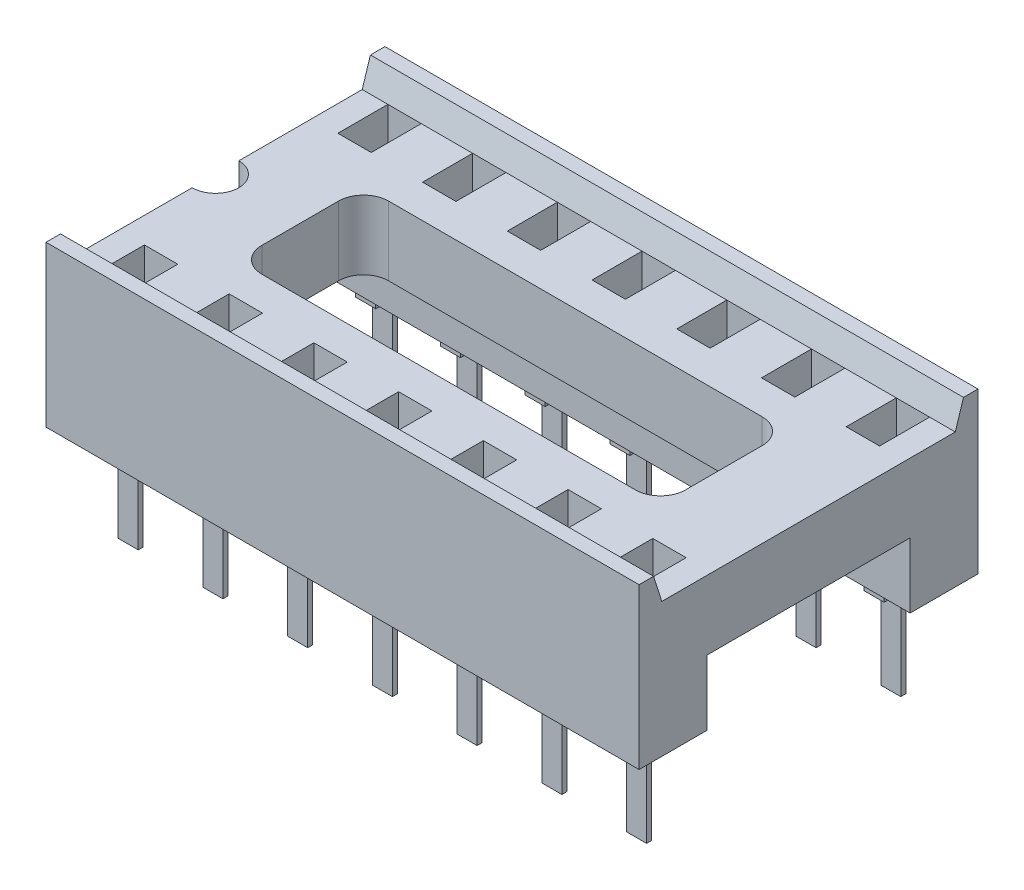
from build123d import *

# Parameters (mm, degrees)
EXTRUDE_1_DEPTH     = 8.89
CUT_EXTRUDE_1_REACH = 14.417
CUT_EXTRUDE_2_REACH = 14.417
SKETCH_3_4_W        = 1
SKETCH_3_4_H        = 1.5
CUT_EXTRUDE_3_DEPTH = 1
SKETCH_4_W          = 0.97
SKETCH_4_H          = 3
SKETCH_4_W_2        = 1.94
CUT_EXTRUDE_4_DEPTH = 14.507158287


with BuildPart() as part:
    # Эскиз2 → Бобышка-Вытянуть1 (new, symmetric)
    with BuildSketch(Plane(origin=(0, 0, 0), x_dir=(0, 0, -1), z_dir=(1, 0, 0))):
        Polygon((4.399571873, 4.024999392), (-4.399571873, 4.024999392), (-4.64484088, 4.8), (-5.08, 4.8), (-5.08, 0), (-3.885, 0), (-3.885, -3), (-3.735, -3), (-3.735, -0.3), (-3.235, -0.3), (-3.235, 0), (-3.045579843, 0), (-3.045579843, 1.95423056), (3.045579843, 1.95423056), (3.045579843, 0), (3.235, 0), (3.235, -0.3), (3.735, -0.3), (3.735, -3), (3.885, -3), (3.885, 0), (5.08, 0), (5.08, 4.8), (4.64484088, 4.8), align=None)
    extrude(amount=EXTRUDE_1_DEPTH, both=True)

    # Эскиз3 → Вырез-Вытянуть1 (cut, up to next)
    with BuildSketch(Plane(origin=(0, 4.024999392, 0), x_dir=(1, 0, 0), z_dir=(0, 1, 0)), mode=Mode.PRIVATE) as cut_extrude_1_sk1:
        with BuildLine():
            Line((-8.89, 0.7), (-8.89, -0.7))
            ThreePointArc((-8.89, -0.7), (-8.19, 0), (-8.89, 0.7))
        make_face()
    cut_extrude_1_tool1 = extrude(cut_extrude_1_sk1.sketch, amount=-CUT_EXTRUDE_1_REACH, mode=Mode.PRIVATE) & part.part
    add(cut_extrude_1_tool1.solids().sort_by_distance((-8.592911, 4.024999, 0))[0], mode=Mode.SUBTRACT)

    # Эскиз3<3> → Вырез-Вытянуть2 (cut, up to next)
    with BuildSketch(Plane(origin=(0, 4.024999392, 0), x_dir=(1, 0, 0), z_dir=(0, 1, 0)), mode=Mode.PRIVATE) as cut_extrude_2_sk1:
        with BuildLine():
            Line((-6.35, 1.149571873), (-6.35, -1.149571873))
            ThreePointArc((-6.35, -1.149571873), (-6.130330086, -1.679901959), (-5.6, -1.899571873))
            Line((-5.6, -1.899571873), (5.6, -1.899571873))
            ThreePointArc((5.6, -1.899571873), (6.130330086, -1.679901959), (6.35, -1.149571873))
            Line((6.35, -1.149571873), (6.35, 1.149571873))
            ThreePointArc((6.35, 1.149571873), (6.130330086, 1.679901959), (5.6, 1.899571873))
            Line((5.6, 1.899571873), (-5.6, 1.899571873))
            ThreePointArc((-5.6, 1.899571873), (-6.130330086, 1.679901959), (-6.35, 1.149571873))
        make_face()
    cut_extrude_2_tool1 = extrude(cut_extrude_2_sk1.sketch, amount=-CUT_EXTRUDE_2_REACH, mode=Mode.PRIVATE) & part.part
    add(cut_extrude_2_tool1.solids().sort_by_distance((0, 4.024999, 0))[0], mode=Mode.SUBTRACT)

    # Эскиз3<4> → Вырез-Вытянуть3 (cut)
    with BuildSketch(Plane(origin=(0, 4.024999392, 0), x_dir=(1, 0, 0), z_dir=(0, 1, 0))):
        with Locations((-7.62, 3.649571873)):
            Rectangle(SKETCH_3_4_W, SKETCH_3_4_H)
        with Locations((7.62, 3.649571873)):
            Rectangle(SKETCH_3_4_W, SKETCH_3_4_H)
        with Locations((5.08, 3.649571873)):
            Rectangle(SKETCH_3_4_W, SKETCH_3_4_H)
        with Locations((2.54, 3.649571873)):
            Rectangle(SKETCH_3_4_W, SKETCH_3_4_H)
        with Locations((0, 3.649571873)):
            Rectangle(SKETCH_3_4_W, SKETCH_3_4_H)
        with Locations((-2.54, 3.649571873)):
            Rectangle(SKETCH_3_4_W, SKETCH_3_4_H)
        with Locations((-5.08, 3.649571873)):
            Rectangle(SKETCH_3_4_W, SKETCH_3_4_H)
        with Locations((-7.62, -3.649571873)):
            Rectangle(SKETCH_3_4_W, SKETCH_3_4_H)
        with Locations((-5.08, -3.649571873)):
            Rectangle(SKETCH_3_4_W, SKETCH_3_4_H)
        with Locations((-2.54, -3.649571873)):
            Rectangle(SKETCH_3_4_W, SKETCH_3_4_H)
        with Locations((0, -3.649571873)):
            Rectangle(SKETCH_3_4_W, SKETCH_3_4_H)
        with Locations((2.54, -3.649571873)):
            Rectangle(SKETCH_3_4_W, SKETCH_3_4_H)
        with Locations((5.08, -3.649571873)):
            Rectangle(SKETCH_3_4_W, SKETCH_3_4_H)
        with Locations((7.62, -3.649571873)):
            Rectangle(SKETCH_3_4_W, SKETCH_3_4_H)
    extrude(amount=-CUT_EXTRUDE_3_DEPTH, mode=Mode.SUBTRACT)

    # Эскиз4 → Вырез-Вытянуть4 (cut, through all)
    with BuildSketch(Plane.XY.offset(3.885)):
        with Locations((-8.405, -1.5)):
            Rectangle(SKETCH_4_W, SKETCH_4_H)
        with Locations((-6.35, -1.5)):
            Rectangle(SKETCH_4_W_2, SKETCH_4_H)
        with Locations((-3.81, -1.5)):
            Rectangle(SKETCH_4_W_2, SKETCH_4_H)
        with Locations((-1.27, -1.5)):
            Rectangle(SKETCH_4_W_2, SKETCH_4_H)
        with Locations((1.27, -1.5)):
            Rectangle(SKETCH_4_W_2, SKETCH_4_H)
        with Locations((3.81, -1.5)):
            Rectangle(SKETCH_4_W_2, SKETCH_4_H)
        with Locations((6.35, -1.5)):
            Rectangle(SKETCH_4_W_2, SKETCH_4_H)
        with Locations((8.405, -1.5)):
            Rectangle(SKETCH_4_W, SKETCH_4_H)
    extrude(amount=-CUT_EXTRUDE_4_DEPTH, mode=Mode.SUBTRACT)


solid = part.part
